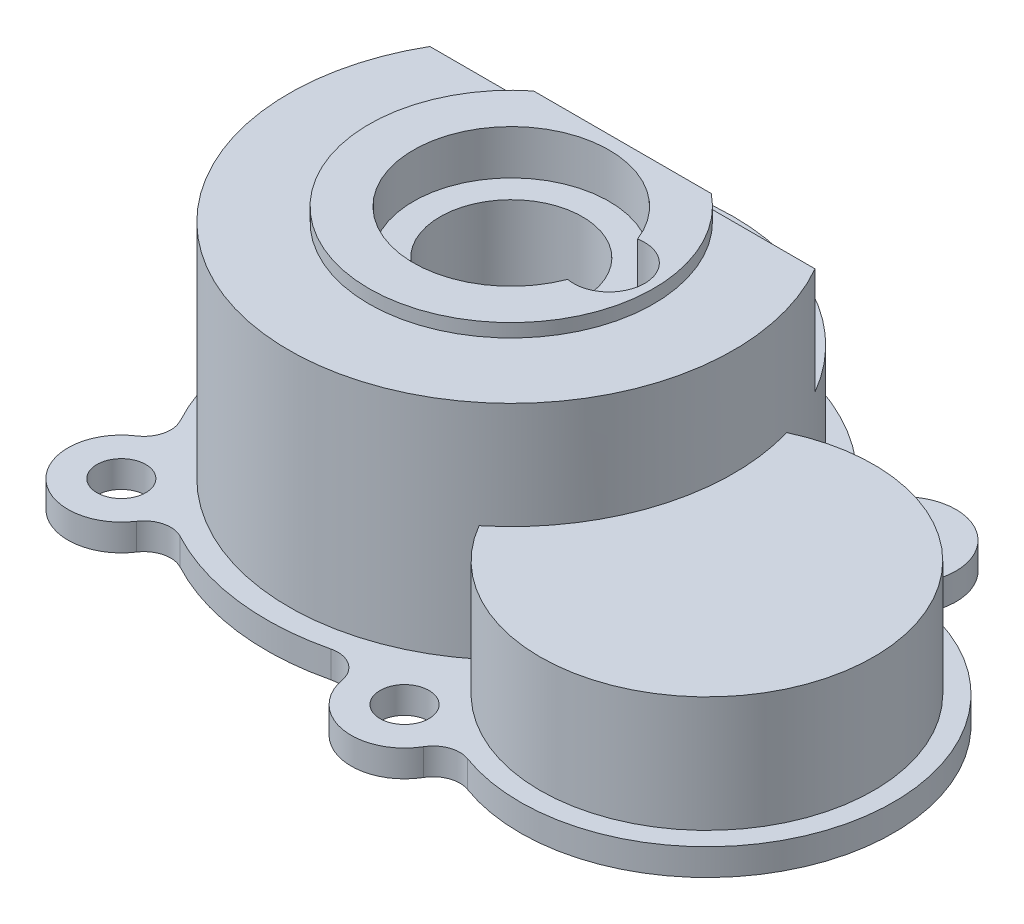
from build123d import *

# Parameters (mm, degrees)
BOSS_EXTRUDE1_DEPTH = 6
SKETCH2_R           = 5.5
CUT_EXTRUDE1_DEPTH  = 6
SKETCH3_R           = 50
BOSS_EXTRUDE2_DEPTH = 50
SKETCH4_R           = 37.5
BOSS_EXTRUDE3_DEPTH = 26
SKETCH5_R           = 32
BOSS_EXTRUDE4_DEPTH = 3
FILLET2_R           = 6
FILLET3_R           = 6
CUT_EXTRUDE2_START  = -27
CUT_EXTRUDE2_DEPTH  = 27
CUT_EXTRUDE3_DEPTH  = 10
SKETCH12_R          = 33
CUT_EXTRUDE9_DEPTH  = 29
SKETCH21_R          = 16
CUT_EXTRUDE16_DEPTH = 35
SKETCH22_R          = 45
CUT_EXTRUDE18_DEPTH = 21
SKETCH34_R          = 45
SKETCH34_R_2        = 25
CUT_EXTRUDE25_DEPTH = 8
CUT_EXTRUDE26_DEPTH = 13


with BuildPart() as part:
    # Sketch1 → Boss-Extrude1 (new body)
    with BuildSketch(Plane(origin=(0, 0, 0), x_dir=(1, 0, 0), z_dir=(0, 1, 0))):
        with BuildLine():
            ThreePointArc((21.211789327, -50.745048956), (28.860136885, -67.581936782), (43.965179902, -56.913493246))
            ThreePointArc((43.965179902, -56.913493246), (104.875389558, -29.654145663), (62.597817721, 21.976587342))
            ThreePointArc((62.597817721, 21.976587342), (62.107138398, 42.329707672), (44.037643352, 32.949749135))
            ThreePointArc((44.037643352, 32.949749135), (8.49481412, 54.340023308), (-31.880473469, 44.817802394))
            ThreePointArc((-31.880473469, 44.817802394), (-52.325901808, 52.325901808), (-44.817802394, 31.880473469))
            ThreePointArc((-44.817802394, 31.880473469), (-55, 0), (-44.817802394, -31.880473469))
            ThreePointArc((-44.817802394, -31.880473469), (-52.325901808, -52.325901808), (-31.880473469, -44.817802394))
            ThreePointArc((-31.880473469, -44.817802394), (-6.102316632, -54.660421986), (21.211789327, -50.745048956))
        make_face()
    extrude(amount=BOSS_EXTRUDE1_DEPTH)

    # Sketch2 → Cut-Extrude1 (cut)
    with BuildSketch(Plane(origin=(0, 6, 0), x_dir=(1, 0, 0), z_dir=(0, 1, 0))):
        with Locations(Location((56, 32, 0), (0, 0, 270))):
            Circle(SKETCH2_R)
        with Locations(Location((-43.840620434, 43.840620434, 0), (0, 0, 270))):
            Circle(SKETCH2_R)
        with Locations(Location((-43.840620434, -43.840620434, 0), (0, 0, 270))):
            Circle(SKETCH2_R)
        with Locations(Location((32, -56, 0), (0, 0, 270))):
            Circle(SKETCH2_R)
    extrude(amount=-CUT_EXTRUDE1_DEPTH, mode=Mode.SUBTRACT)

    # Sketch3 → Boss-Extrude2 (add)
    with BuildSketch(Plane(origin=(0, 6, 0), x_dir=(1, 0, 0), z_dir=(0, 1, 0))):
        with Locations(Location((0, 0, 0), (0, 0, 270))):
            Circle(SKETCH3_R)
    extrude(amount=BOSS_EXTRUDE2_DEPTH)

    # Sketch4 → Boss-Extrude3 (add)
    with BuildSketch(Plane(origin=(0, 6, 0), x_dir=(1, 0, 0), z_dir=(0, 1, 0))):
        with Locations((64, -20)):
            Circle(SKETCH4_R)
    extrude(amount=BOSS_EXTRUDE3_DEPTH)

    # Sketch5 → Boss-Extrude4 (add)
    with BuildSketch(Plane(origin=(0, 56, 0), x_dir=(1, 0, 0), z_dir=(0, 1, 0))):
        with Locations(Location((0, 0, 0), (0, 0, 270))):
            Circle(SKETCH5_R)
    extrude(amount=BOSS_EXTRUDE4_DEPTH)

    # Fillet2
    fillet2_edges = [part.edges().sort_by_distance(p)[0] for p in [
        (44.037643352, 3, -32.949749135),
    ]]
    fillet(fillet2_edges, radius=FILLET2_R)

    # Fillet3
    fillet3_edges = [part.edges().sort_by_distance(p)[0] for p in [
        (21.211789327, 3, 50.745048956),
        (-31.880473469, 3, 44.817802394),
        (-44.817802394, 3, 31.880473469),
        (-44.817802394, 3, -31.880473469),
        (-31.880473469, 3, -44.817802394),
        (62.597817721, 3, -21.976587342),
        (43.965179902, 3, 56.913493246),
    ]]
    fillet(fillet3_edges, radius=FILLET3_R)

    # Sketch6 → Cut-Extrude2 (cut)
    with BuildSketch(Plane(origin=(0, 59, 0), x_dir=(1, 0, 0), z_dir=(0, 1, 0)).offset(CUT_EXTRUDE2_START)):
        with BuildLine():
            Line((0, 25), (43.301270189, 25))
            ThreePointArc((43.301270189, 25), (0, 50), (-43.301270189, 25))
            Line((-43.301270189, 25), (0, 25))
        make_face()
    extrude(amount=CUT_EXTRUDE2_DEPTH, mode=Mode.SUBTRACT)

    # Sketch7 → Cut-Extrude3 (cut)
    with BuildSketch(Plane(origin=(0, 59, 0), x_dir=(1, 0, 0), z_dir=(0, 1, 0))):
        with BuildLine():
            ThreePointArc((20.545454545, 7.866657328), (-22, 0), (20.545454545, -7.866657328))
            ThreePointArc((20.545454545, -7.866657328), (30, 0), (20.545454545, 7.866657328))
        make_face()
    extrude(amount=-CUT_EXTRUDE3_DEPTH, mode=Mode.SUBTRACT)

    # Sketch12 → Cut-Extrude9 (cut)
    with BuildSketch(Plane.XZ):
        with Locations(Location((64, 20, 0), (0, 0, 270))):
            Circle(SKETCH12_R)
    extrude(amount=-CUT_EXTRUDE9_DEPTH, mode=Mode.SUBTRACT)

    # Sketch21 → Cut-Extrude16 (cut)
    with BuildSketch(Plane(origin=(0, 56, 0), x_dir=(1, 0, 0), z_dir=(0, 1, 0))):
        with Locations(Location((0, 0, 0), (0, 0, 270))):
            Circle(SKETCH21_R)
    extrude(amount=-CUT_EXTRUDE16_DEPTH, mode=Mode.SUBTRACT)

    # Sketch22 → Cut-Extrude18 (cut)
    with BuildSketch(Plane.XZ):
        Circle(SKETCH22_R)
    extrude(amount=-CUT_EXTRUDE18_DEPTH, mode=Mode.SUBTRACT)

    # Sketch34 → Cut-Extrude25 (cut)
    with BuildSketch(Plane(origin=(0, 21, 0), x_dir=(-1, 0, 0), z_dir=(0, -1, 0))):
        Circle(SKETCH34_R)
        with Locations(Location((0, 0, 0), (0, 0, 90))):
            Circle(SKETCH34_R_2, mode=Mode.SUBTRACT)
    extrude(amount=-CUT_EXTRUDE25_DEPTH, mode=Mode.SUBTRACT)

    # Sketch35 → Cut-Extrude26 (cut)
    with BuildSketch(Plane.XZ.offset(-29)):
        with BuildLine():
            Line((15, -20), (40.311288741, -20))
            ThreePointArc((40.311288741, -20), (0, 45), (-40.311288741, -20))
            Line((-40.311288741, -20), (-15, -20))
            ThreePointArc((-15, -20), (-13.588689929, 20.984458678), (24.386363636, 5.505022125))
            ThreePointArc((24.386363636, 5.505022125), (28, 0), (24.386363636, -5.505022125))
            ThreePointArc((24.386363636, -5.505022125), (20.984458678, -13.588689929), (15, -20))
        make_face()
    extrude(amount=-CUT_EXTRUDE26_DEPTH, mode=Mode.SUBTRACT)


solid = part.part
